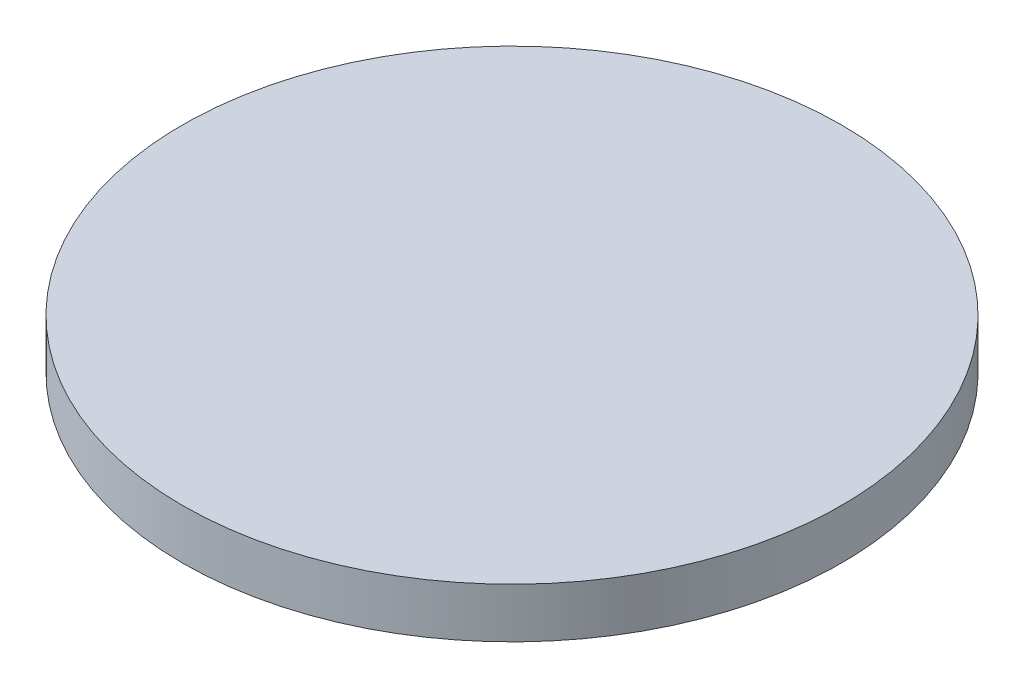
from build123d import *

# Parameters (mm, degrees)
SKETCH1_W           = 127.635
SKETCH1_H           = 127.635
MAIN_PLATE_DEPTH    = 12.7
SKETCH9_R           = 85.725
BOSS_EXTRUDE1_DEPTH = 12.7
SKETCH10_R          = 97.039626961
SKETCH10_R_2        = 83.82
CUT_EXTRUDE1_DEPTH  = 167.64


with BuildPart() as part:
    # Sketch1 → Main Plate (new body)
    with BuildSketch(Plane(origin=(0, 0, 0), x_dir=(1, 0, 0), z_dir=(0, 1, 0))):
        with Locations((63.8175, 63.8175)):
            Rectangle(SKETCH1_W, SKETCH1_H)
    extrude(amount=MAIN_PLATE_DEPTH)

    # Sketch9 → Boss-Extrude1 (add)
    with BuildSketch(Plane(origin=(0, 12.7, 0), x_dir=(1, 0, 0), z_dir=(0, 1, 0))):
        with Locations((63.8175, 63.8175)):
            Circle(SKETCH9_R)
    extrude(amount=-BOSS_EXTRUDE1_DEPTH)

    # Sketch10 → Cut-Extrude1 (cut)
    with BuildSketch(Plane(origin=(0, 12.7, 0), x_dir=(1, 0, 0), z_dir=(0, 1, 0))):
        with Locations((63.8175, 63.8175)):
            Circle(SKETCH10_R)
        with Locations(Location((63.8175, 63.8175, 0), (0, 0, 270))):
            Circle(SKETCH10_R_2, mode=Mode.SUBTRACT)
    extrude(amount=-CUT_EXTRUDE1_DEPTH, mode=Mode.SUBTRACT)


solid = part.part
